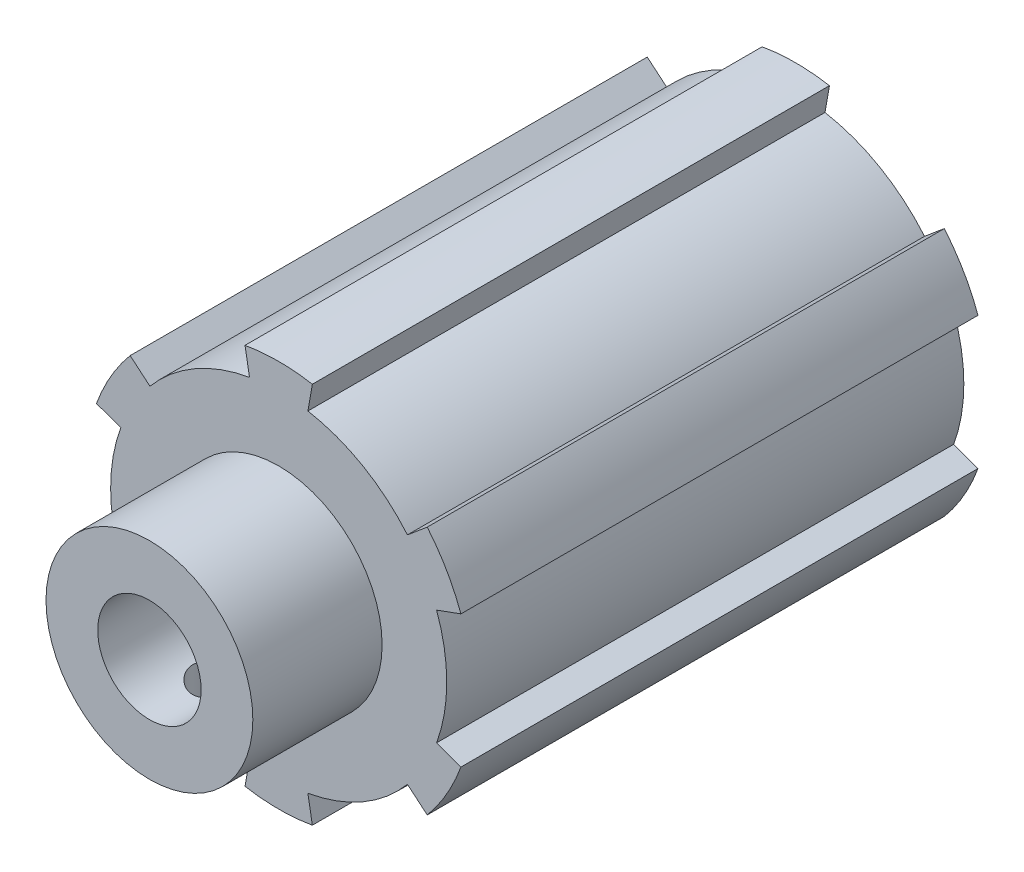
from build123d import *

# Parameters (mm, degrees)
ESQUISSE1_R             = 60
BOSS_EXTRU_1_DEPTH      = 40
CUT_EXTRUDE4_DEPTH      = 94.808315196
CIRPATTERN1_COUNT       = 10
SKETCH4_R               = 8
BOSS_EXTRUDE1_DEPTH     = 10
SKETCH5_R               = 4
CUT_EXTRUDE5_DEPTH      = 99.488578018
CUT_EXTRUDE6_START      = -20
CUT_EXTRUDE6_DEPTH      = 20
CIRPATTERN2_COUNT       = 15
CUT_EXTRUDE7_DEPTH      = 20
CIRPATTERN3_COUNT       = 15
CUT_EXTRUDE8_DEPTH      = 94.808315196
CUT_EXTRUDE8_DEPTH_BACK = 94.808315196
SKETCH8_OUTSIDE_W       = 157.384
SKETCH8_OUTSIDE_H       = 157.384
CUT_EXTRUDE9_REACH      = 56.071
SKETCH9_R               = 1.65


with BuildPart() as part:
    # Esquisse1 → Boss.-Extru.1 (new body)
    with BuildSketch(Plane.XY):
        Circle(ESQUISSE1_R)
    extrude(amount=BOSS_EXTRU_1_DEPTH)

    # Sketch3 → Cut-Extrude4 (cut, symmetric)
    with BuildSketch(Plane.XY):
        with BuildLine():
            Line((-3.943348831, 23.180571367), (-7.5, 44.087980221))
            ThreePointArc((-7.5, 44.087980221), (-6.481937987, 48.04148707), (-2.856459957, 49.918339681))
            ThreePointArc((-2.856459957, 49.918339681), (0, 50), (2.856459957, 49.918339681))
            ThreePointArc((2.856459957, 49.918339681), (6.481937987, 48.04148707), (7.5, 44.087980221))
            Line((7.5, 44.087980221), (3.943348831, 23.180571367))
            ThreePointArc((3.943348831, 23.180571367), (0, 19.85139176), (-3.943348831, 23.180571367))
        make_face()
    cut_extrude4 = extrude(amount=CUT_EXTRUDE4_DEPTH, both=True, mode=Mode.SUBTRACT)

    # CirPattern1: Cut-Extrude4 ×10 about axis
    cirpattern1_axis = Axis((0, 0, -2), (0, 0, 1))
    for i in range(1, CIRPATTERN1_COUNT):
        add(cut_extrude4.rotate(cirpattern1_axis, i * 360 / CIRPATTERN1_COUNT), mode=Mode.SUBTRACT)

    # Sketch4 → Boss-Extrude1 (add)
    with BuildSketch(Plane.XY.offset(40)):
        Circle(SKETCH4_R)
    extrude(amount=BOSS_EXTRUDE1_DEPTH)

    # Sketch5 → Cut-Extrude5 (cut, through all)
    with BuildSketch(Plane.XY.offset(50)):
        Circle(SKETCH5_R)
    extrude(amount=-CUT_EXTRUDE5_DEPTH, mode=Mode.SUBTRACT)

    # Sketch6 → Cut-Extrude6 (cut)
    with BuildSketch(Plane.XY.offset(40).offset(CUT_EXTRUDE6_START)):
        with BuildLine():
            ThreePointArc((15.529142706, 57.955549577), (12.986376836, 58.577760427), (10.41889066, 59.088465181))
            Line((10.41889066, 59.088465181), (9.897946127, 56.134041922))
            ThreePointArc((9.897946127, 56.134041922), (12.337057994, 55.648872406), (14.752685571, 55.057772098))
            Line((14.752685571, 55.057772098), (15.529142706, 57.955549577))
        make_face()
    cut_extrude6 = extrude(amount=CUT_EXTRUDE6_DEPTH, mode=Mode.SUBTRACT)

    # CirPattern2: Cut-Extrude6 ×15 about axis
    cirpattern2_axis = Axis((0, 0, -2), (0, 0, 1))
    for i in range(1, CIRPATTERN2_COUNT):
        add(cut_extrude6.rotate(cirpattern2_axis, i * 360 / CIRPATTERN2_COUNT), mode=Mode.SUBTRACT)

    # Sketch7 → Cut-Extrude7 (cut)
    with BuildSketch(Plane(origin=(0, 0, 0), x_dir=(-1, 0, 0), z_dir=(0, 0, -1))):
        with BuildLine():
            Line((-2.617163242, 59.942893295), (-2.48630508, 56.94574863))
            ThreePointArc((-2.48630508, 56.94574863), (0, 57), (2.48630508, 56.94574863))
            Line((2.48630508, 56.94574863), (2.617163242, 59.942893295))
            ThreePointArc((2.617163242, 59.942893295), (0, 60), (-2.617163242, 59.942893295))
        make_face()
    cut_extrude7 = extrude(amount=-CUT_EXTRUDE7_DEPTH, mode=Mode.SUBTRACT)

    # CirPattern3: Cut-Extrude7 ×15 about axis
    cirpattern3_axis = Axis((0, 0, 15), (0, 0, -1))
    for i in range(1, CIRPATTERN3_COUNT):
        add(cut_extrude7.rotate(cirpattern3_axis, i * 360 / CIRPATTERN3_COUNT), mode=Mode.SUBTRACT)

    # Sketch8 outside → Cut-Extrude8 (cut, two sides: drawn at the far end of the back side and taken through both)
    with BuildSketch(Plane.XY.offset(40).offset(-CUT_EXTRUDE8_DEPTH_BACK)):
        Rectangle(SKETCH8_OUTSIDE_W, SKETCH8_OUTSIDE_H)
        with BuildLine():
            Line((-2.604722665, 14.772116295), (-2.25742631, 12.802500789))
            ThreePointArc((-2.25742631, 12.802500789), (-6.5, 11.258330249), (-9.958577761, 8.356238926))
            Line((-9.958577761, 8.356238926), (-11.490666647, 9.641814145))
            ThreePointArc((-11.490666647, 9.641814145), (-12.990381057, 7.5), (-14.095389312, 5.13030215))
            Line((-14.095389312, 5.13030215), (-12.21600407, 4.446261863))
            ThreePointArc((-12.21600407, 4.446261863), (-13, 0), (-12.21600407, -4.446261863))
            Line((-12.21600407, -4.446261863), (-14.095389312, -5.13030215))
            ThreePointArc((-14.095389312, -5.13030215), (-12.990381057, -7.5), (-11.490666647, -9.641814145))
            Line((-11.490666647, -9.641814145), (-9.958577761, -8.356238926))
            ThreePointArc((-9.958577761, -8.356238926), (-6.5, -11.258330249), (-2.25742631, -12.802500789))
            Line((-2.25742631, -12.802500789), (-2.604722665, -14.772116295))
            ThreePointArc((-2.604722665, -14.772116295), (0, -15), (2.604722665, -14.772116295))
            Line((2.604722665, -14.772116295), (2.25742631, -12.802500789))
            ThreePointArc((2.25742631, -12.802500789), (6.5, -11.258330249), (9.958577761, -8.356238926))
            Line((9.958577761, -8.356238926), (11.490666647, -9.641814145))
            ThreePointArc((11.490666647, -9.641814145), (12.990381057, -7.5), (14.095389312, -5.13030215))
            Line((14.095389312, -5.13030215), (12.21600407, -4.446261863))
            ThreePointArc((12.21600407, -4.446261863), (13, 0), (12.21600407, 4.446261863))
            Line((12.21600407, 4.446261863), (14.095389312, 5.13030215))
            ThreePointArc((14.095389312, 5.13030215), (12.990381057, 7.5), (11.490666647, 9.641814145))
            Line((11.490666647, 9.641814145), (9.958577761, 8.356238926))
            ThreePointArc((9.958577761, 8.356238926), (6.5, 11.258330249), (2.25742631, 12.802500789))
            Line((2.25742631, 12.802500789), (2.604722665, 14.772116295))
            ThreePointArc((2.604722665, 14.772116295), (0, 15), (-2.604722665, 14.772116295))
        make_face(mode=Mode.SUBTRACT)
    extrude(amount=CUT_EXTRUDE8_DEPTH + CUT_EXTRUDE8_DEPTH_BACK, mode=Mode.SUBTRACT)

    # Sketch9 → Cut-Extrude9 (cut, up to next)
    with BuildSketch(Plane(origin=(0, 0, 0), x_dir=(1, 0, 0), z_dir=(0, 1, 0)), mode=Mode.PRIVATE) as cut_extrude9_sk1:
        with Locations((0, -45)):
            Circle(SKETCH9_R)
    cut_extrude9_tool1 = extrude(cut_extrude9_sk1.sketch, amount=-CUT_EXTRUDE9_REACH, mode=Mode.PRIVATE) & part.part
    add(cut_extrude9_tool1.solids().sort_by_distance((0, 0, 45))[0], mode=Mode.SUBTRACT)


solid = part.part
